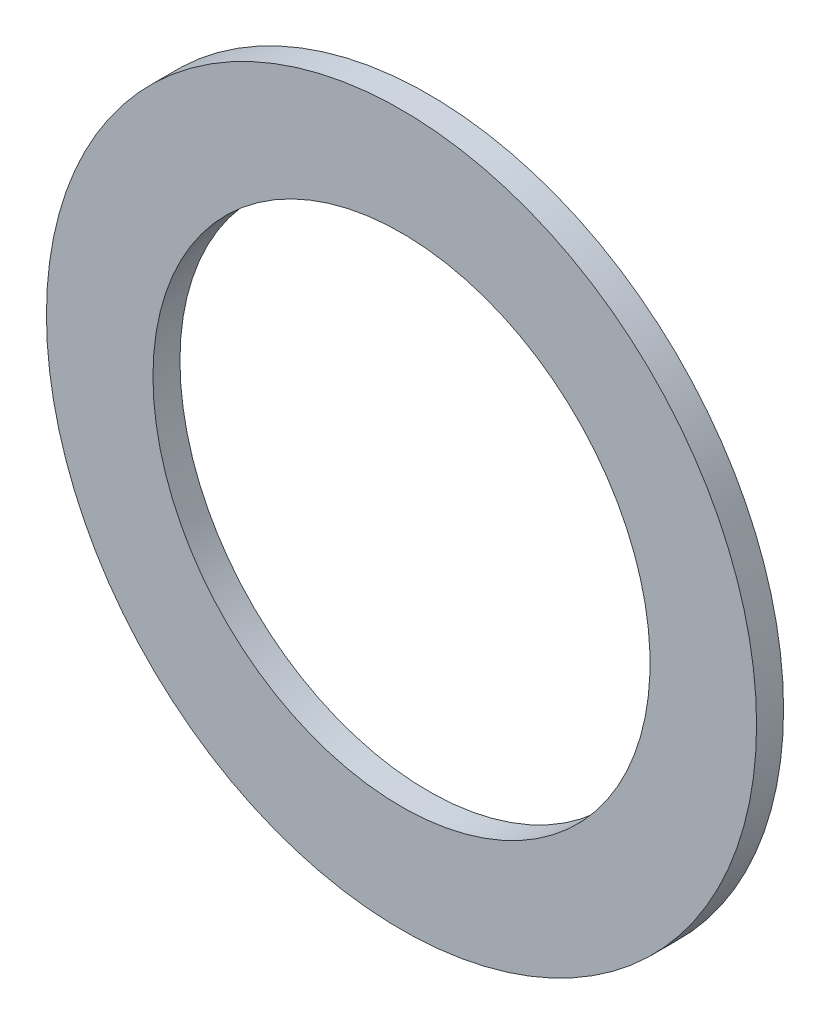
from build123d import *

# Parameters (mm, degrees)
ESBO_O1_R       = 12.5
ESBO_O1_R_2     = 8.75
EXTRUS_O1_DEPTH = 0.95


with BuildPart() as part:
    # Esboço1 → Extrusão1 (new body)
    with BuildSketch(Plane.XY):
        with Locations(Location((0, 0, 0), (0, 0, 180))):
            Circle(ESBO_O1_R)
        with Locations(Location((0, 0, 0), (0, 0, 180))):
            Circle(ESBO_O1_R_2, mode=Mode.SUBTRACT)
    extrude(amount=EXTRUS_O1_DEPTH)


solid = part.part
